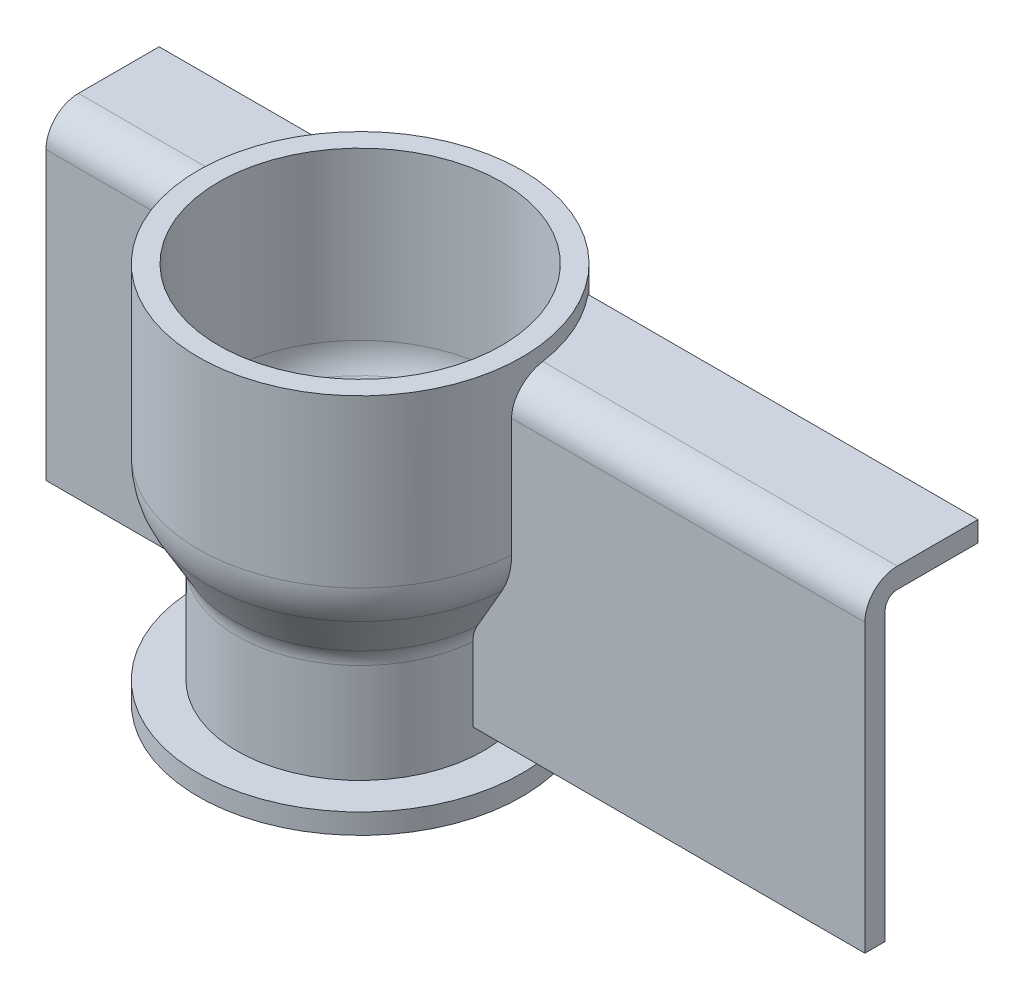
from build123d import *

# Parameters (mm, degrees)
EXTRUDE_1_REACH   = 195.29
SKETCH_3_R        = 39.925
EXTRUDE_1_2_DEPTH = 5
EXTRUDE_3_REACH   = 228.308


with BuildPart() as part:
    # strainer → 旋轉-薄件1 (revolve)
    with BuildSketch(Plane.XY, mode=Mode.PRIVATE) as revolve_1_sk:
        with BuildLine():
            Line((-34.925, 0), (-34.925, -41.047045184))
            ThreePointArc((-34.925, -41.047045184), (-34.492257994, -44.334047057), (-33.223522628, -47.397045184))
            Line((-33.223522628, -47.397045184), (-27.101477372, -58.000738614))
            ThreePointArc((-27.101477372, -58.000738614), (-25.832742006, -61.063736741), (-25.4, -64.350738614))
            Line((-25.4, -64.350738614), (-25.4, -88.9))
            Line((-25.4, -88.9), (-30.4, -88.9))
            Line((-30.4, -88.9), (-30.4, -64.350738614))
            ThreePointArc((-30.4, -64.350738614), (-30.662371138, -62.357831967), (-31.431604391, -60.500738614))
            Line((-31.431604391, -60.500738614), (-37.553649647, -49.897045184))
            ThreePointArc((-37.553649647, -49.897045184), (-39.321887125, -45.628142282), (-39.925, -41.047045184))
            Line((-39.925, -41.047045184), (-39.925, 0))
            Line((-39.925, 0), (-34.925, 0))
        make_face()
    revolve(revolve_1_sk.sketch.rotate(Axis((0, 0, 0), (0, 1, 0)), 270), axis=Axis((0, 0, 0), (0, 1, 0)))

    # bracket → Extrude 1 (add, up to next)
    with BuildSketch(Plane(origin=(127, 0, 0), x_dir=(0, 0, -1), z_dir=(1, 0, 0)), mode=Mode.PRIVATE) as extrude_1_sk1:
        with BuildLine():
            Line((25.4, -3.85), (5.5, -3.85))
            ThreePointArc((5.5, -3.85), (-0.156854249, -6.193145751), (-2.5, -11.85))
            Line((-2.5, -11.85), (-2.5, -82.55))
            Line((-2.5, -82.55), (2.5, -82.55))
            Line((2.5, -82.55), (2.5, -11.85))
            ThreePointArc((2.5, -11.85), (3.378679656, -9.728679656), (5.5, -8.85))
            Line((5.5, -8.85), (25.4, -8.85))
            Line((25.4, -8.85), (25.4, -3.85))
        make_face()
    extrude_1_tool1 = extrude(extrude_1_sk1.sketch, amount=-EXTRUDE_1_REACH, mode=Mode.PRIVATE) - part.part
    add(extrude_1_tool1.solids().sort_by_distance((127, -4.684991, -15.45))[0])

    # 草圖3 → Extrude 1 2 (add)
    with BuildSketch(Plane.XZ.offset(88.9)):
        with Locations(Location((0, 0, 0), (0, 0, 270))):
            Circle(SKETCH_3_R)
    extrude(amount=EXTRUDE_1_2_DEPTH)

    # 草圖4 → 填料-伸長3 (add, up to next)
    with BuildSketch(Plane(origin=(-75, 0, 0), x_dir=(0, 0, -1), z_dir=(1, 0, 0)), mode=Mode.PRIVATE) as extrude_3_sk1:
        with BuildLine():
            Line((5.5, -8.85), (25.4, -8.85))
            Line((25.4, -8.85), (25.4, -3.85))
            Line((25.4, -3.85), (5.5, -3.85))
            ThreePointArc((5.5, -3.85), (-0.156854249, -6.193145751), (-2.5, -11.85))
            Line((-2.5, -11.85), (-2.5, -82.55))
            Line((-2.5, -82.55), (2.5, -82.55))
            Line((2.5, -82.55), (2.5, -11.85))
            ThreePointArc((2.5, -11.85), (3.378679656, -9.728679656), (5.5, -8.85))
        make_face()
    extrude_3_tool1 = extrude(extrude_3_sk1.sketch, amount=EXTRUDE_3_REACH, mode=Mode.PRIVATE) - part.part
    add(extrude_3_tool1.solids().sort_by_distance((-75, -9.138252, -2.788252))[0])


solid = part.part
